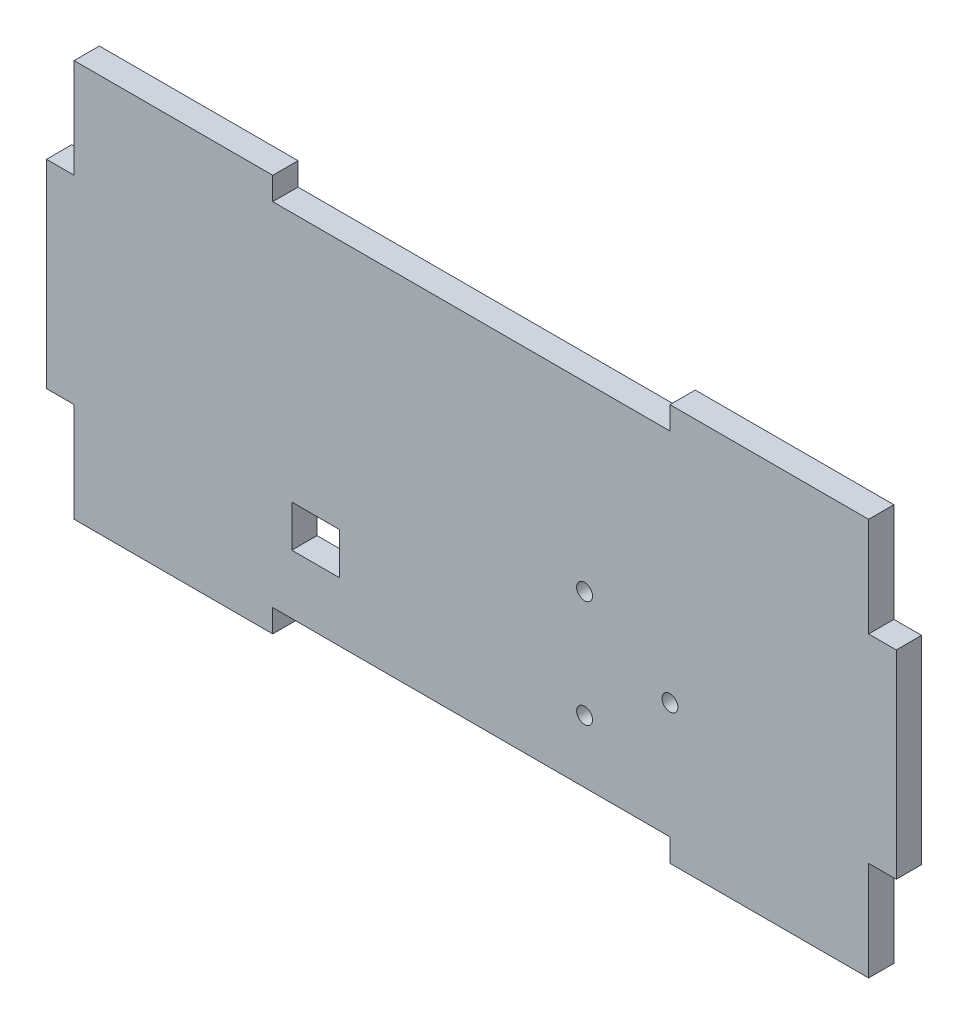
from build123d import *

# Parameters (mm, degrees)
SKETCH1_W           = 200
SKETCH1_H           = 100
BOSS_EXTRUDE1_DEPTH = 6.36
SKETCH9_W           = 6.96
SKETCH9_H           = 50
BOSS_EXTRUDE5_DEPTH = 6.36
SKETCH10_W          = 100
SKETCH10_H          = 5.76
CUT_EXTRUDE1_DEPTH  = 119.240818671
SKETCH13_R          = 2
BATTERY_HOLES_DEPTH = 10
SKETCH14_W          = 12
SKETCH14_H          = 10.5
CUT_EXTRUDE6_DEPTH  = 119.240818671


with BuildPart() as part:
    # Sketch1 → Boss-Extrude1 (new body)
    with BuildSketch(Plane.XY):
        Rectangle(SKETCH1_W, SKETCH1_H)
    extrude(amount=BOSS_EXTRUDE1_DEPTH)

    # Sketch9 → Boss-Extrude5 (add)
    with BuildSketch(Plane(origin=(0, 0, 0), x_dir=(-1, 0, 0), z_dir=(0, 0, -1))):
        with Locations((103.48, 0)):
            Rectangle(SKETCH9_W, SKETCH9_H)
    boss_extrude5 = extrude(amount=-BOSS_EXTRUDE5_DEPTH)

    # Mirror5: Boss-Extrude5 across plane
    add(boss_extrude5.mirror(Plane(origin=(0, 0, 0), x_dir=(0, 0, 1), z_dir=(1, 0, 0))))

    # Sketch10 → Cut-Extrude1 (cut, symmetric)
    with BuildSketch(Plane.XY.offset(6.36)):
        with Locations((0, 47.12)):
            Rectangle(SKETCH10_W, SKETCH10_H)
    cut_extrude1 = extrude(amount=CUT_EXTRUDE1_DEPTH, both=True, mode=Mode.SUBTRACT)

    # Mirror6: Cut-Extrude1 across plane
    add(cut_extrude1.mirror(Plane.ZX), mode=Mode.SUBTRACT)

    # Sketch13 → battery holes (cut)
    with BuildSketch(Plane.XY.offset(6.36)):
        with Locations((50, -15)):
            Circle(SKETCH13_R)
        with Locations((28.5, -1.5)):
            Circle(SKETCH13_R)
        with Locations((28.5, -28.5)):
            Circle(SKETCH13_R)
    extrude(amount=-BATTERY_HOLES_DEPTH, mode=Mode.SUBTRACT)

    # Sketch14 → Cut-Extrude6 (cut, through all)
    with BuildSketch(Plane(origin=(0, 0, 0), x_dir=(-1, 0, 0), z_dir=(0, 0, -1))):
        with Locations((39.2, -24.09)):
            Rectangle(SKETCH14_W, SKETCH14_H)
    extrude(amount=-CUT_EXTRUDE6_DEPTH, mode=Mode.SUBTRACT)


solid = part.part
